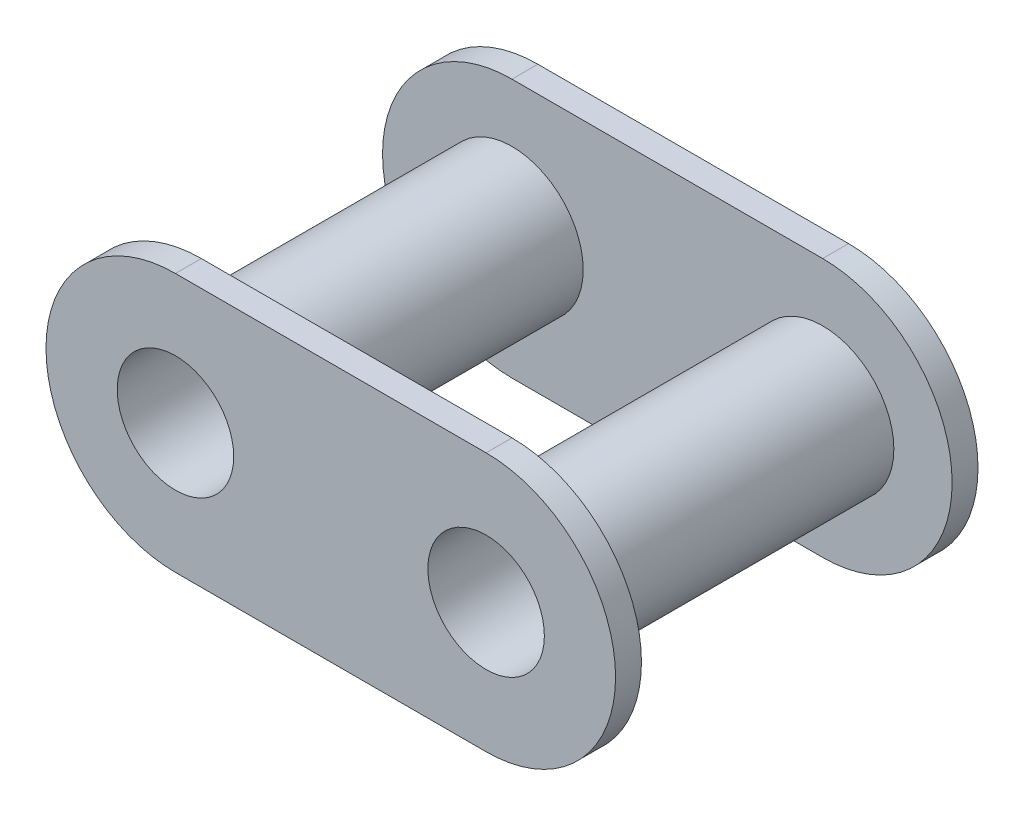
from build123d import *

# Parameters (mm, degrees)
SKETCH1_R           = 1.125
BOSS_EXTRUDE1_DEPTH = 0.5
SKETCH2_R           = 1.375
SKETCH2_R_2         = 1.125
EXTRUDE_THIN1_DEPTH = 3


with BuildPart() as part:
    # Sketch1 → Boss-Extrude1 (new body)
    with BuildSketch(Plane.XY):
        with BuildLine():
            Line((-3, 2.5), (3, 2.5))
            ThreePointArc((3, 2.5), (5.5, 0), (3, -2.5))
            Line((3, -2.5), (-3, -2.5))
            ThreePointArc((-3, -2.5), (-5.5, 0), (-3, 2.5))
        make_face()
        with Locations((-3, 0)):
            Circle(SKETCH1_R, mode=Mode.SUBTRACT)
        with Locations((3, 0)):
            Circle(SKETCH1_R, mode=Mode.SUBTRACT)
    boss_extrude1 = extrude(amount=BOSS_EXTRUDE1_DEPTH)

    # Sketch2 → Extrude-Thin1 (add)
    # profile 1 of 2: a face of its own
    with BuildSketch(Plane.XY.offset(0.5)):
        with Locations((-3, 0)):
            Circle(SKETCH2_R)
        with Locations((-3, 0)):
            Circle(SKETCH2_R_2, mode=Mode.SUBTRACT)
    # profile 2 of 2: a face of its own
    with BuildSketch(Plane.XY.offset(0.5)):
        with Locations((3, 0)):
            Circle(SKETCH2_R)
        with Locations((3, 0)):
            Circle(SKETCH2_R_2, mode=Mode.SUBTRACT)
    extrude_thin1 = extrude(amount=EXTRUDE_THIN1_DEPTH)

    # Mirror1: Boss-Extrude1, Extrude-Thin1 across plane
    add(boss_extrude1.mirror(Plane.XY.offset(3.5)))
    add(extrude_thin1.mirror(Plane.XY.offset(3.5)))


solid = part.part
